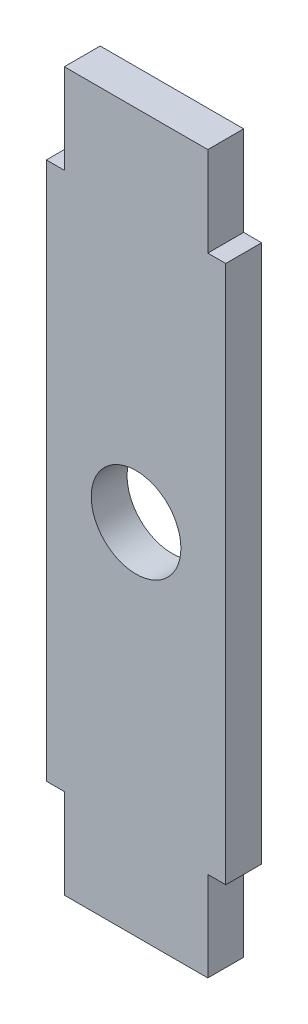
from build123d import *

# Parameters (mm, degrees)
SKETCH1_R           = 2.5
BOSS_EXTRUDE1_DEPTH = 2


with BuildPart() as part:
    # Sketch1 → Boss-Extrude1 (new body)
    with BuildSketch(Plane.XY):
        Polygon((-4, -15), (-5, -15), (-5, 15), (-4, 15), (-4, 20), (4, 20), (4, 15), (5, 15), (5, -15), (4, -15), (4, -20), (-4, -20), align=None)
        Circle(SKETCH1_R, mode=Mode.SUBTRACT)
    extrude(amount=BOSS_EXTRUDE1_DEPTH)


solid = part.part
